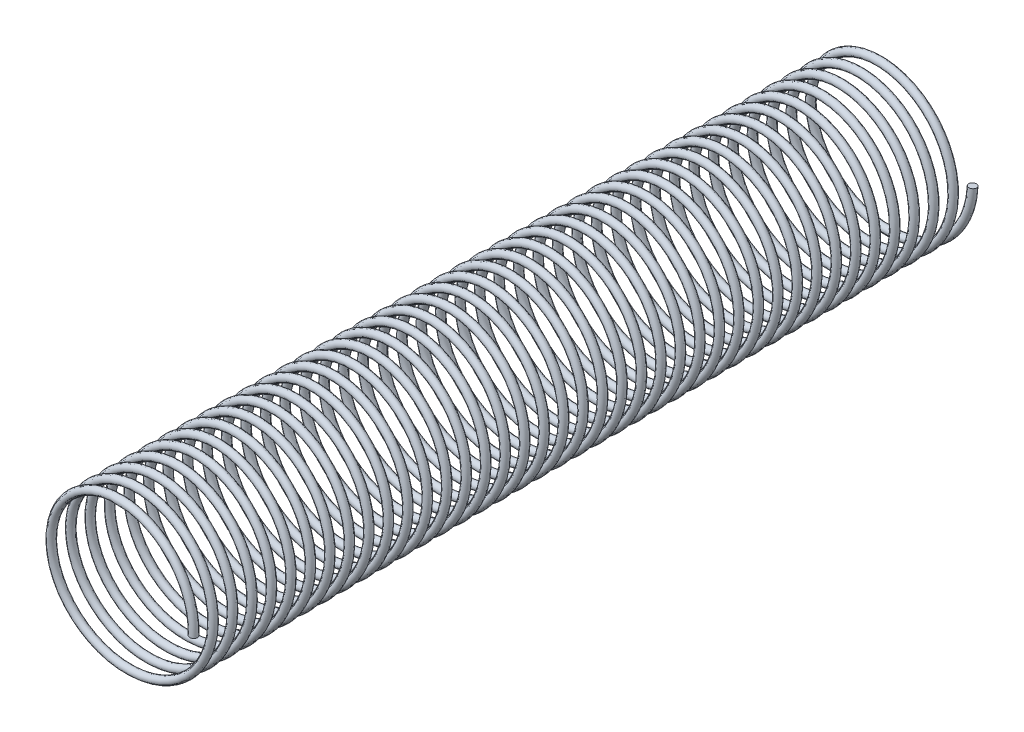
from build123d import *

# Parameters (mm, degrees)
BALAYAGE3_PITCH     = 0.5125
BALAYAGE3_HEIGHT    = 20.5
BALAYAGE3_RADIUS    = 2
BALAYAGE3_PROFILE_R = 0.1


with BuildPart() as part:
    # Balayage3: sweep along a helix
    with BuildLine() as balayage3_path:
        Helix(BALAYAGE3_PITCH, BALAYAGE3_HEIGHT, BALAYAGE3_RADIUS, center=(1.5, 0, 0), direction=(0, 0, 1), lefthand=True)
    # Balayage3 profile (on start of the path) → Balayage3 (sweep)
    with BuildSketch(Plane(origin=(3.5, 0, 0), x_dir=(0, -0.04074957906109104, -0.9991693909474729), z_dir=(2.1005297960062125e-13, -0.9991693909474729, 0.04074957906109104))):
        Circle(BALAYAGE3_PROFILE_R)
    sweep(path=balayage3_path.line, is_frenet=True)


solid = part.part
